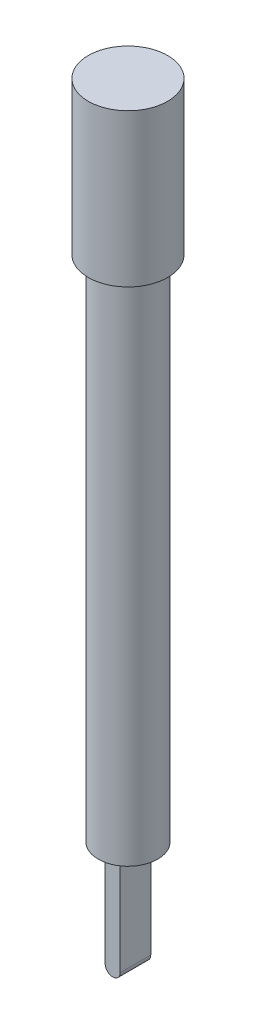
from build123d import *

# Parameters (mm, degrees)
SKETCH1_R                = 5.85
BOSS_EXTRUDE1_DEPTH      = 100
SKETCH2_R                = 7.8
BOSS_EXTRUDE2_DEPTH      = 30
BOSS_EXTRUDE3_DEPTH      = 3
BOSS_EXTRUDE3_DEPTH_BACK = 3


with BuildPart() as part:
    # Sketch1 → Boss-Extrude1 (new body)
    with BuildSketch(Plane(origin=(0, 0, 0), x_dir=(1, 0, 0), z_dir=(0, 1, 0))):
        Circle(SKETCH1_R)
    extrude(amount=BOSS_EXTRUDE1_DEPTH)

    # Sketch2 → Boss-Extrude2 (add)
    with BuildSketch(Plane(origin=(0, 100, 0), x_dir=(1, 0, 0), z_dir=(0, 1, 0))):
        Circle(SKETCH2_R)
    extrude(amount=BOSS_EXTRUDE2_DEPTH)

    # Sketch3 → Boss-Extrude3 (add, two sides: drawn at the far end of the back side and taken through both)
    with BuildSketch(Plane.XY.offset(-BOSS_EXTRUDE3_DEPTH_BACK)):
        with BuildLine():
            Line((1.478387163, -20), (1.478387163, 0))
            Line((1.478387163, 0), (-1.478387163, 0))
            Line((-1.478387163, 0), (-1.478387163, -20))
            ThreePointArc((-1.478387163, -20), (0, -21.478387163), (1.478387163, -20))
        make_face()
    extrude(amount=BOSS_EXTRUDE3_DEPTH + BOSS_EXTRUDE3_DEPTH_BACK)


solid = part.part
